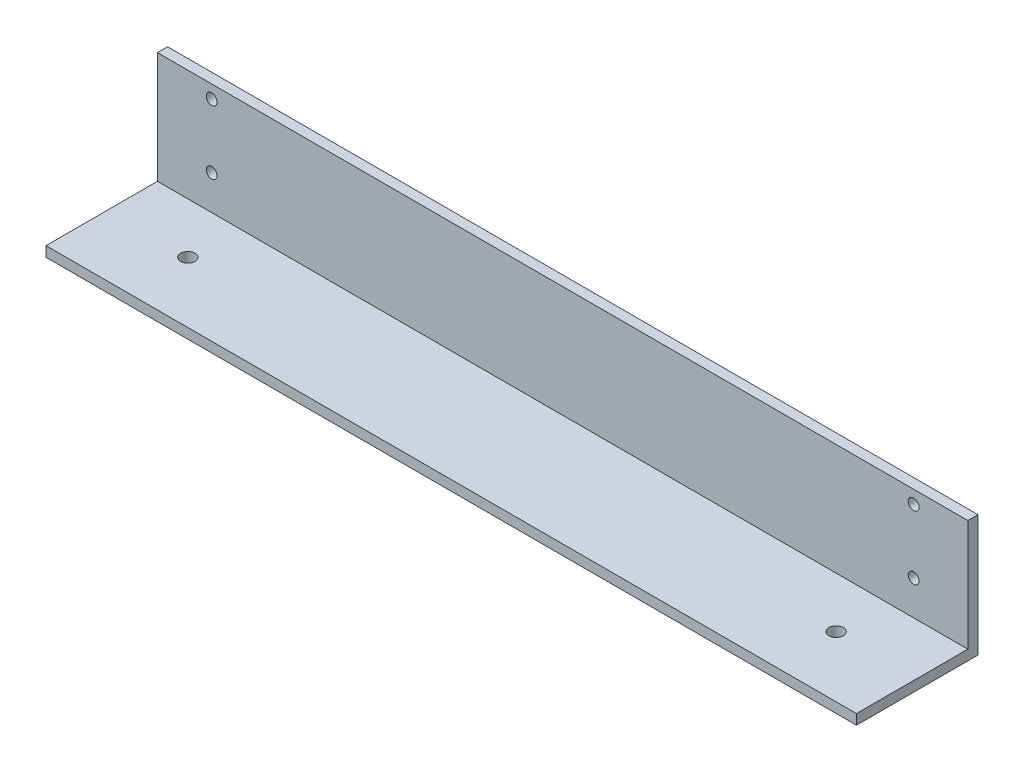
from build123d import *

# Parameters (mm, degrees)
BOSS_EXTRUDE1_DEPTH   = 254
M3_CLEARANCE_HOLE1_D  = 3.4
F_8_CLEARANCE_HOLE1_D = 4.4958


with BuildPart() as part:
    # Sketch1 → Boss-Extrude1 (new body)
    with BuildSketch(Plane(origin=(0, 0, 0), x_dir=(0, 0, -1), z_dir=(1, 0, 0))):
        Polygon((0, 0), (-34.925, 0), (-34.925, -3.175), (3.175, -3.175), (3.175, 34.925), (0, 34.925), align=None)
    extrude(amount=BOSS_EXTRUDE1_DEPTH)

    # M3 Clearance Hole1 (through all)
    with Locations(Plane.XY):
        with Locations((17, 30.825), (17, 10.825), (237, 10.825), (237, 30.825)):
            Hole(M3_CLEARANCE_HOLE1_D / 2)

    # #8 Clearance Hole1 (through all)
    with Locations(Plane(origin=(0, 0, 0), x_dir=(1, 0, 0), z_dir=(0, 1, 0))):
        with Locations((25.4, -15.875), (228.6, -15.875)):
            Hole(F_8_CLEARANCE_HOLE1_D / 2)


solid = part.part
